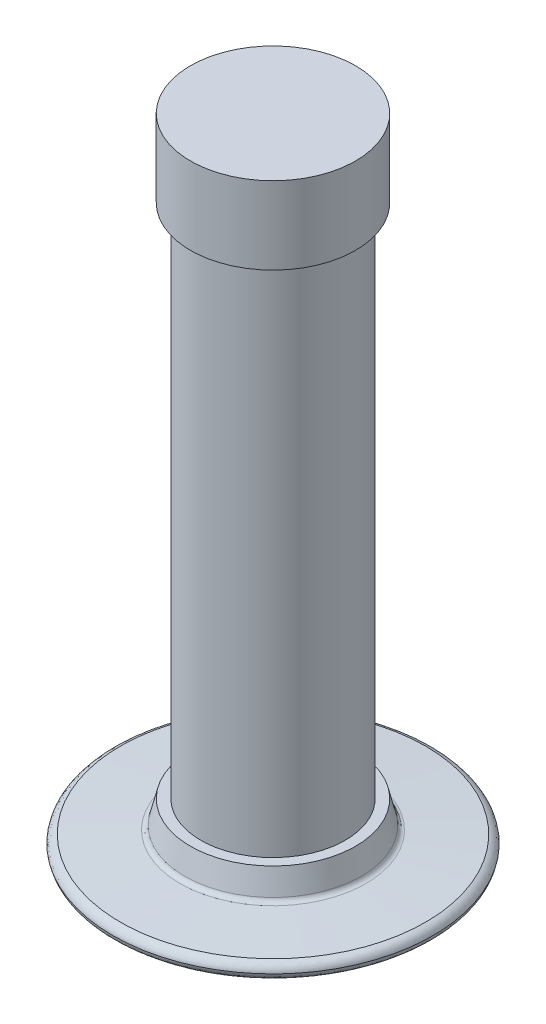
from build123d import *


with BuildPart() as part:
    # Sketch1 → Revolve1 (revolve)
    with BuildSketch(Plane.XY, mode=Mode.PRIVATE) as revolve1_sk:
        with BuildLine():
            Line((0, 0), (0, 130))
            Line((0, 130), (16, 130))
            Line((16, 130), (16, 115))
            Line((16, 115), (14, 115))
            Line((14, 115), (14, 15))
            Line((14, 15), (16, 15))
            Line((16, 15), (17.111692668, 10.512431094))
            ThreePointArc((17.111692668, 10.512431094), (17.441933325, 9.984863822), (18.020263304, 9.754819144))
            Line((18.020263304, 9.754819144), (29.564485303, 9.036667386))
            add(Edge.make_bspline(
                [(29.564485303, 9.036667386), (30.853089791, 8.614064405), (31, 7.5)],
                knots=[0, 0, 0, 1, 1, 1], degree=2))
            add(Edge.make_bspline(
                [(29.564485303, 5.963332614), (30.853089791, 6.385935595), (31, 7.5)],
                knots=[0, 0, 0, 1, 1, 1], degree=2))
            Line((29.564485303, 5.963332614), (18.020263304, 5.245180856))
            ThreePointArc((18.020263304, 5.245180856), (17.441933325, 5.015136178), (17.111692668, 4.487568906))
            Line((17.111692668, 4.487568906), (16, 0))
            Line((16, 0), (0, 0))
        make_face()
    revolve(revolve1_sk.sketch.rotate(Axis((0, 0, 0), (0, 1, 0)), 90), axis=Axis((0, 0, 0), (0, 1, 0)))


solid = part.part
